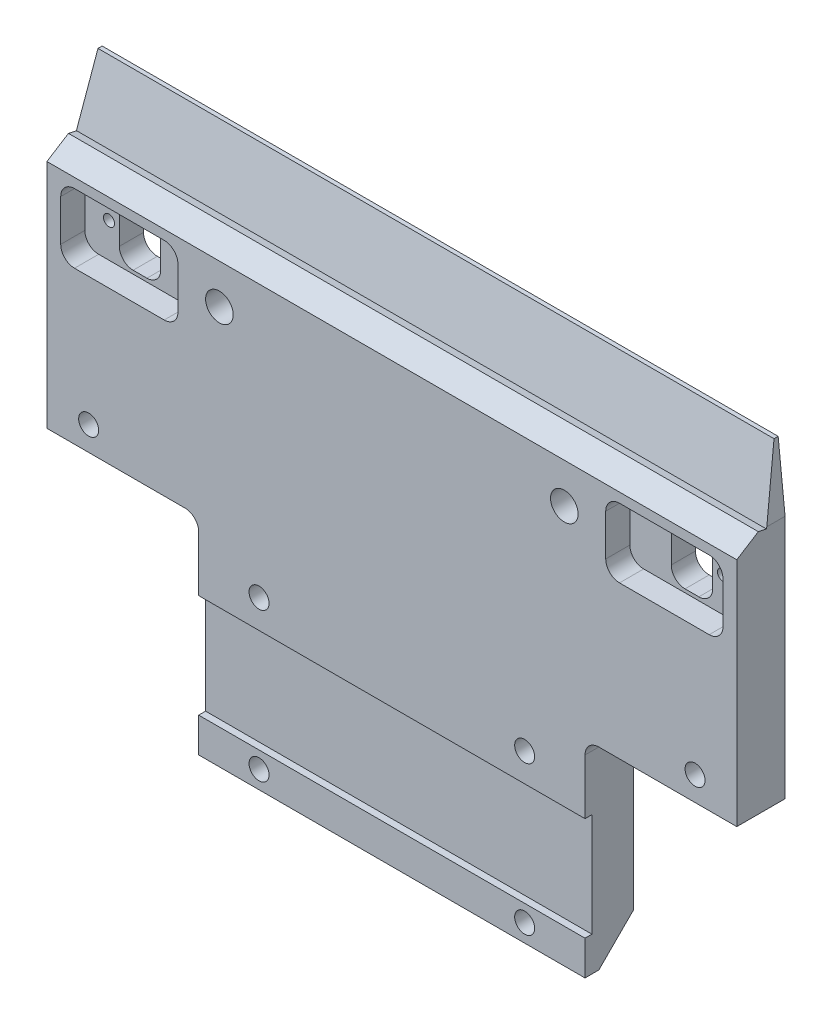
from build123d import *

# Parameters (mm, degrees)
ESBO_O1_W                = 56
ESBO_O1_H                = 30
ESBO_O1_W_2              = 100
ESBO_O1_H_2              = 45
RESSALTO_EXTRUS_O1_DEPTH = 7
CORTE_EXTRUS_O1_DEPTH    = 176.483223745
CORTE_EXTRUS_O2_DEPTH    = 164.946216229
ESBO_O5_W                = 17
ESBO_O5_H                = 10
CORTE_EXTRUS_O4_DEPTH    = 3.5
CORTE_EXTRUS_O6_DEPTH    = 24
FILETE1_R                = 2
FILETE2_R                = 2
ESBO_O8_R                = 0.8
ESBO_O8_W                = 6
ESBO_O8_H                = 9
CORTE_EXTRUS_O7_DEPTH    = 24
FILETE3_R                = 2
ESBO_O9_W                = 56
ESBO_O9_H                = 15
CORTE_EXTRUS_O8_DEPTH    = 1
ESBO_O10_R               = 1.45
CORTE_EXTRUS_O9_DEPTH    = 17
ESBO_O11_R               = 2
CORTE_EXTRUS_O10_DEPTH   = 15
CHANFRO1_SIZE            = 2
ESBO_O12_R               = 1.45
CORTE_EXTRUS_O11_DEPTH   = 15


with BuildPart() as part:
    # Esboço1 → Ressalto-extrusão1 (new body)
    with BuildSketch(Plane.XY):
        with Locations((15.481715893, -129.032502637)):
            Rectangle(ESBO_O1_W, ESBO_O1_H)
        with Locations((15.481715893, -91.532502637)):
            Rectangle(ESBO_O1_W_2, ESBO_O1_H_2)
    extrude(amount=RESSALTO_EXTRUS_O1_DEPTH)

    # Esboço2 → Corte-extrusão1 (cut, through all)
    with BuildSketch(Plane.ZY.offset(34.518284107)):
        Polygon((0.6, -69.032502637), (7, -69.032502637), (7, -80.532502637), (3.876629102, -78.564484615), (2.702851981, -78.813978644), align=None)
    extrude(amount=-CORTE_EXTRUS_O1_DEPTH, mode=Mode.SUBTRACT)

    # Esboço3 → Corte-extrusão2 (cut, through all)
    with BuildSketch(Plane(origin=(43.481715893, 0, 0), x_dir=(0, 0, -1), z_dir=(1, 0, 0))):
        Polygon((-5, -144.032502637), (0, -139.032502637), (0, -144.032502637), align=None)
    extrude(amount=-CORTE_EXTRUS_O2_DEPTH, mode=Mode.SUBTRACT)

    # Esboço5 → Corte-extrusão4 (cut)
    with BuildSketch(Plane.XY.offset(7)):
        with Locations((-24.018284107, -86.931905633)):
            Rectangle(ESBO_O5_W, ESBO_O5_H)
        with Locations((54.981715893, -86.931905633)):
            Rectangle(ESBO_O5_W, ESBO_O5_H)
    extrude(amount=-CORTE_EXTRUS_O4_DEPTH, mode=Mode.SUBTRACT)

    # Esboço7 → Corte-extrusão6 (cut)
    with BuildSketch(Plane.XY.offset(7)):
        Polygon((64.477557131, -69.032502637), (65.481715893, -69.032502637), (65.481715893, -78.564484615), align=None)
        Polygon((-34.518284107, -78.564484615), (-33.514125345, -69.032502637), (-34.518284107, -69.032502637), align=None)
    extrude(amount=-CORTE_EXTRUS_O6_DEPTH, mode=Mode.SUBTRACT)

    # Filete1
    filete1_edges = [part.edges().sort_by_distance(p)[0] for p in [
        (-32.518284107, -91.931905633, 5.25),
        (-32.518284107, -81.931905633, 5.25),
        (-15.518284107, -81.931905633, 5.25),
        (-15.518284107, -91.931905633, 5.25),
        (46.481715893, -91.931905633, 5.25),
        (46.481715893, -81.931905633, 5.25),
        (63.481715893, -81.931905633, 5.25),
        (63.481715893, -91.931905633, 5.25),
    ]]
    fillet(filete1_edges, radius=FILETE1_R)

    # Filete2
    filete2_edges = [part.edges().sort_by_distance(p)[0] for p in [
        (-12.518284107, -114.032502637, 3.5),
        (43.481715893, -114.032502637, 3.5),
    ]]
    fillet(filete2_edges, radius=FILETE2_R)

    # Esboço8 → Corte-extrusão7 (cut)
    with BuildSketch(Plane.XY.offset(7)):
        with Locations((59.981716293, -86.931906013)):
            Circle(ESBO_O8_R)
        with Locations((-29.018284507, -86.931905253)):
            Circle(ESBO_O8_R)
        with Locations((-24.518284107, -86.931905633)):
            Rectangle(ESBO_O8_W, ESBO_O8_H)
        with Locations((55.481715893, -86.931905633)):
            Rectangle(ESBO_O8_W, ESBO_O8_H)
    extrude(amount=-CORTE_EXTRUS_O7_DEPTH, mode=Mode.SUBTRACT)

    # Filete3
    filete3_edges = [part.edges().sort_by_distance(p)[0] for p in [
        (-27.518284107, -91.431905633, 1.75),
        (-27.518284107, -82.431905633, 1.75),
        (-21.518284107, -82.431905633, 1.75),
        (-21.518284107, -91.431905633, 1.75),
        (52.481715893, -91.431905633, 1.75),
        (52.481715893, -82.431905633, 1.75),
        (58.481715893, -82.431905633, 1.75),
        (58.481715893, -91.431905633, 1.75),
    ]]
    fillet(filete3_edges, radius=FILETE3_R)

    # Esboço9 → Corte-extrusão8 (cut)
    with BuildSketch(Plane.XY.offset(7)):
        with Locations((15.481715893, -131.532502637)):
            Rectangle(ESBO_O9_W, ESBO_O9_H)
    extrude(amount=-CORTE_EXTRUS_O8_DEPTH, mode=Mode.SUBTRACT)

    # Esboço10 → Corte-extrusão9 (cut)
    with BuildSketch(Plane.XY.offset(7)):
        with Locations((-3.768284107, -119.906030775)):
            Circle(ESBO_O10_R)
        with Locations((34.731715893, -119.906030775)):
            Circle(ESBO_O10_R)
        with Locations((34.731715893, -141.457502637)):
            Circle(ESBO_O10_R)
        with Locations((-3.768284107, -141.457502637)):
            Circle(ESBO_O10_R)
    extrude(amount=-CORTE_EXTRUS_O9_DEPTH, mode=Mode.SUBTRACT)

    # Esboço11 → Corte-extrusão10 (cut)
    with BuildSketch(Plane(origin=(0, 0, 0), x_dir=(-1, 0, 0), z_dir=(0, 0, -1))):
        with Locations((-40.481715893, -86.292423409)):
            Circle(ESBO_O11_R)
        with Locations((9.518284107, -86.292423409)):
            Circle(ESBO_O11_R)
    extrude(amount=-CORTE_EXTRUS_O10_DEPTH, mode=Mode.SUBTRACT)

    # Chanfro1
    chanfro1_edges = [part.edges().sort_by_distance(p)[0] for p in [
        (42.481715893, -86.292423409, 0),
        (-7.518284107, -86.292423409, 0),
    ]]
    chamfer(chanfro1_edges, length=CHANFRO1_SIZE)

    # Esboço12 → Corte-extrusão11 (cut)
    with BuildSketch(Plane(origin=(0, 0, 0), x_dir=(-1, 0, 0), z_dir=(0, 0, -1))):
        with Locations((-59.431715893, -110.532502637)):
            Circle(ESBO_O12_R)
        with Locations((28.468284107, -110.532502637)):
            Circle(ESBO_O12_R)
    extrude(amount=-CORTE_EXTRUS_O11_DEPTH, mode=Mode.SUBTRACT)


solid = part.part
